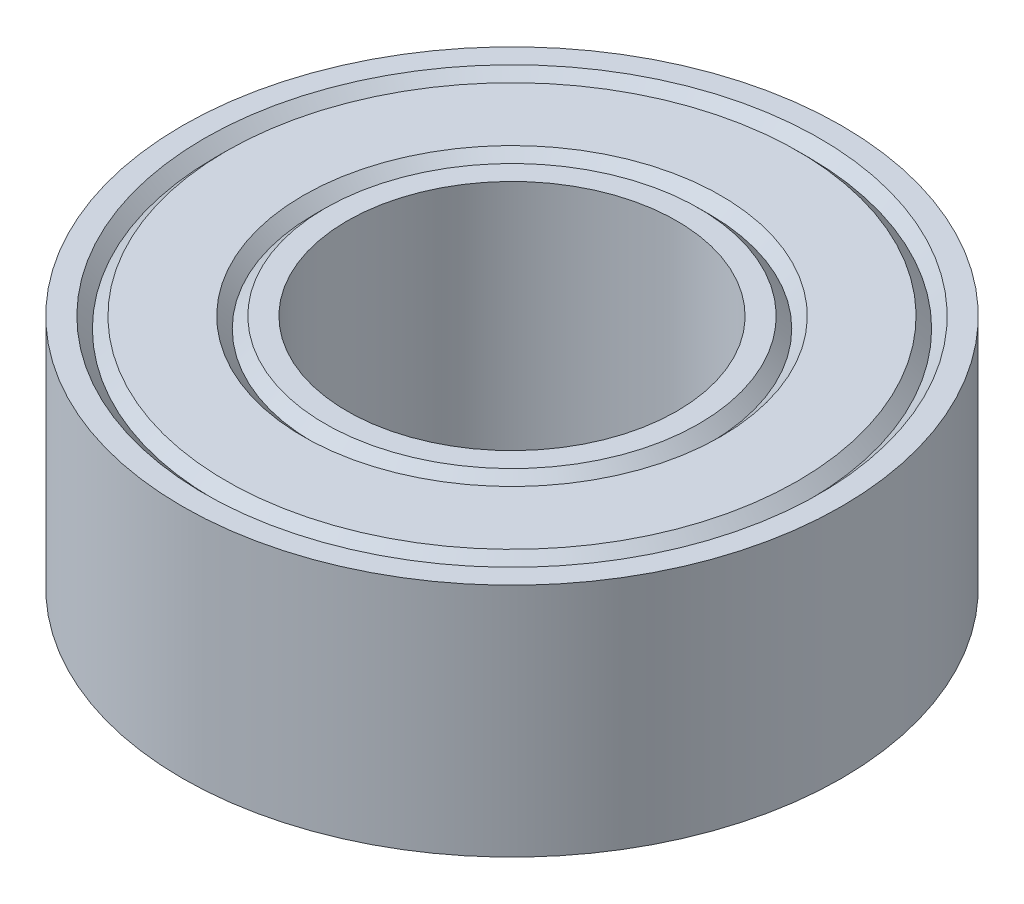
from build123d import *


with BuildPart() as part:
    # Sketch1 → Revolve1 (revolve)
    with BuildSketch(Plane.XY):
        Polygon((-3.5, 2.5), (-3.966666667, 2.5), (-4.2, 2.266666667), (-4.433333333, 2.5), (-6.066666667, 2.5), (-6.3, 2.266666667), (-6.533333333, 2.5), (-7, 2.5), (-7, -2.5), (-6.533333333, -2.5), (-6.3, -2.266666667), (-6.066666667, -2.5), (-4.433333333, -2.5), (-4.2, -2.266666667), (-3.966666667, -2.5), (-3.5, -2.5), align=None)
    revolve(axis=Axis((0, 2.5, 0), (0, -1, 0)))


solid = part.part
